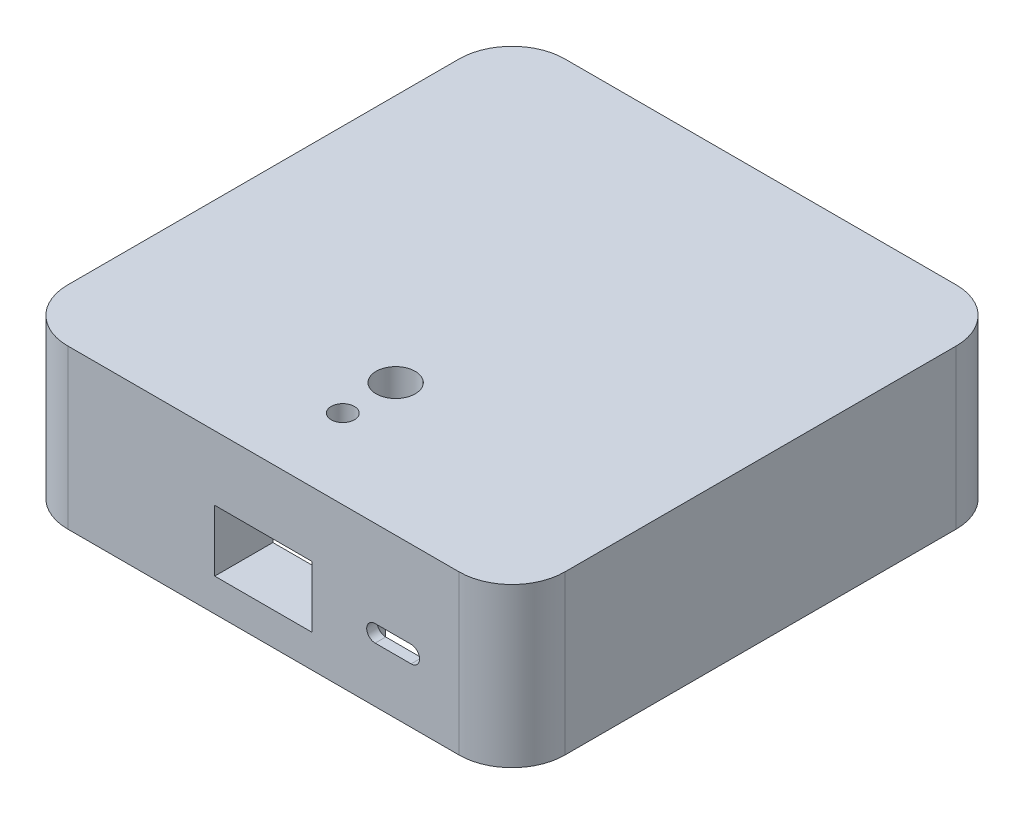
from build123d import *

# Parameters (mm, degrees)
SKETCH_1_W             = 94
SKETCH_1_H             = 94
EXTRUDE_1_DEPTH        = 30
FILLET_1_R             = 10
SHELL_1_T              = -2
SKETCH_2_W             = 24.1
SKETCH_2_H             = 30
EXTRUDE_3392_DEPTH     = 11
CUT_EXTRUDE_3513_REACH = 111.293
SKETCH_3_W             = 18.42
SKETCH_3_H             = 11.6
SKETCH_4_W             = 24.1
SKETCH_4_H             = 24.1
CUT_EXTRUDE_3826_DEPTH = 1.4
EXTRUDE_4548_DEPTH     = 14.2
SKETCH_9_W             = 69.4
SKETCH_9_H             = 9.2
SKETCH_10_W            = 5
SKETCH_10_H            = 5
EXTRUDE_5202_DEPTH     = 24.19
CUT_EXTRUDE_5310_DEPTH = 4
USBC_REACH             = 111.293
USBC_2_DEPTH           = 26
SKETCH_22_W            = 24.1
SKETCH_22_H            = 10.2
EXTRUDE_7617_DEPTH     = 24.95
CUT_EXTRUDE_6_REACH    = 70.81
SKETCH_23_R            = 2.2
SKETCH_23_R_2          = 3.7
SKETCH_13_W            = 10.3
SKETCH_13_H            = 10.3
EXTRUDE_4_DEPTH        = 28
CUT_EXTRUDE_7_DEPTH    = 4


with BuildPart() as part:
    # 草图1 → 凸台-拉伸1 (new body)
    with BuildSketch(Plane(origin=(0, 0, 0), x_dir=(1, 0, 0), z_dir=(0, 1, 0))):
        Rectangle(SKETCH_1_W, SKETCH_1_H)
    extrude(amount=EXTRUDE_1_DEPTH)

    # 圆角1
    fillet_1_edges = [part.edges().sort_by_distance(p)[0] for p in [
        (-47, 15, -47),
        (47, 15, -47),
        (47, 15, 47),
        (-47, 15, 47),
    ]]
    fillet(fillet_1_edges, radius=FILLET_1_R)

    # 抽壳1
    shell_1_openings = [part.faces().sort_by_distance(p)[0] for p in [
        (0, 0, 0),
    ]]
    offset(amount=SHELL_1_T, openings=shell_1_openings, kind=Kind.INTERSECTION)

    # 草图2 → Extrude 3392 (add)
    with BuildSketch(Plane.XY.offset(47)):
        with Locations((0, 15)):
            Rectangle(SKETCH_2_W, SKETCH_2_H)
    extrude(amount=-EXTRUDE_3392_DEPTH)

    # 草图3 → Cut-Extrude 3513 (cut, up to next)
    with BuildSketch(Plane.XY.offset(47), mode=Mode.PRIVATE) as cut_extrude_3513_sk1:
        with Locations((0, 12)):
            Rectangle(SKETCH_3_W, SKETCH_3_H)
    cut_extrude_3513_tool1 = extrude(cut_extrude_3513_sk1.sketch, amount=-CUT_EXTRUDE_3513_REACH, mode=Mode.PRIVATE) & part.part
    add(cut_extrude_3513_tool1.solids().sort_by_distance((0, 12, 47))[0], mode=Mode.SUBTRACT)

    # 草图4 → Cut-Extrude 3826 (cut)
    with BuildSketch(Plane.XZ.offset(-28)):
        with Locations((0, -1)):
            Rectangle(SKETCH_4_W, SKETCH_4_H)
    extrude(amount=-CUT_EXTRUDE_3826_DEPTH, mode=Mode.SUBTRACT)

    # 草图6 → Extrude 4548 (add)
    with BuildSketch(Plane.XZ.offset(-28)):
        with BuildLine():
            Line((-45, -37), (-45, -21.630094022))
            Line((-45, -21.630094022), (45, -21.630094022))
            Line((45, -21.630094022), (45, -37))
            ThreePointArc((45, -37), (42.656854249, -42.656854249), (37, -45))
            Line((37, -45), (-37, -45))
            ThreePointArc((-37, -45), (-42.656854249, -42.656854249), (-45, -37))
        make_face()
    extrude(amount=EXTRUDE_4548_DEPTH)

    # 草图9 → Cut-Revolve 4776 (revolve, cut)
    with BuildSketch(Plane.XZ.offset(-13.8)):
        with Locations((0, -31.2)):
            Rectangle(SKETCH_9_W, SKETCH_9_H)
    revolve(axis=Axis((-34.7, 13.8, -35.8), (1, 0, 0)), mode=Mode.SUBTRACT)

    # 草图10 → Extrude 5202 (add)
    with BuildSketch(Plane.XZ.offset(-28)):
        with Locations((-24, 23)):
            Rectangle(SKETCH_10_W, SKETCH_10_H)
        with Locations((24, -9)):
            Rectangle(SKETCH_10_W, SKETCH_10_H)
    extrude(amount=EXTRUDE_5202_DEPTH)

    # 草图11 → Cut-Extrude 5310 (cut)
    with BuildSketch(Plane.XZ.offset(-3.81)):
        Polygon((-23.076239569, 21.4), (-22.152479139, 23), (-23.076239569, 24.6), (-24.923760431, 24.6), (-25.847520861, 23), (-24.923760431, 21.4), align=None)
        Polygon((24.923760431, -10.6), (25.847520861, -9), (24.923760431, -7.4), (23.076239569, -7.4), (22.152479139, -9), (23.076239569, -10.6), align=None)
    extrude(amount=-CUT_EXTRUDE_5310_DEPTH, mode=Mode.SUBTRACT)

    # 草图15 → USBC (cut, up to next)
    with BuildSketch(Plane.XY.offset(47), mode=Mode.PRIVATE) as usbc_sk1:
        with BuildLine():
            Line((21.125, 13.6), (27.925, 13.6))
            ThreePointArc((27.925, 13.6), (29.525, 12), (27.925, 10.4))
            Line((27.925, 10.4), (21.125, 10.4))
            ThreePointArc((21.125, 10.4), (19.525, 12), (21.125, 13.6))
        make_face()
    usbc_tool1 = extrude(usbc_sk1.sketch, amount=-USBC_REACH, mode=Mode.PRIVATE) & part.part
    add(usbc_tool1.solids().sort_by_distance((24.525, 12, 47))[0], mode=Mode.SUBTRACT)

    # 草图16 → USBC 2 (add)
    with BuildSketch(Plane(origin=(0, 0, 45), x_dir=(-1, 0, 0), z_dir=(0, 0, -1))):
        Polygon((-15.225, 13), (-16.025, 13), (-16.025, 14.6), (-18.858333333, 14.6), (-18.858333333, 28), (-15.225, 28), align=None)
        Polygon((-30.191666667, 28), (-33.825, 28), (-33.825, 13), (-33.025, 13), (-33.025, 14.6), (-30.191666667, 14.6), align=None)
    extrude(amount=USBC_2_DEPTH)

    # 草图22 → Extrude 7617 (add)
    with BuildSketch(Plane(origin=(0, 0, 36), x_dir=(-1, 0, 0), z_dir=(0, 0, -1))):
        with Locations((0, 22.9)):
            Rectangle(SKETCH_22_W, SKETCH_22_H)
    extrude(amount=EXTRUDE_7617_DEPTH)

    # 草图23 → 切除-拉伸6 (cut, up to next)
    with BuildSketch(Plane(origin=(0, 17.8, 0), x_dir=(-1, 0, 0), z_dir=(0, -1, 0)), mode=Mode.PRIVATE) as cut_extrude_6_sk1:
        with Locations(Location((0, -32, 0), (0, 0, 180))):
            Circle(SKETCH_23_R)
    cut_extrude_6_tool1 = extrude(cut_extrude_6_sk1.sketch, amount=-CUT_EXTRUDE_6_REACH, mode=Mode.PRIVATE) & part.part
    # 草图23 → 切除-拉伸6 (cut, up to next)
    with BuildSketch(Plane(origin=(0, 17.8, 0), x_dir=(-1, 0, 0), z_dir=(0, -1, 0)), mode=Mode.PRIVATE) as cut_extrude_6_sk2:
        with Locations(Location((0, -22, 0), (0, 0, 180))):
            Circle(SKETCH_23_R_2)
    cut_extrude_6_tool2 = extrude(cut_extrude_6_sk2.sketch, amount=-CUT_EXTRUDE_6_REACH, mode=Mode.PRIVATE) & part.part
    add(cut_extrude_6_tool1.solids().sort_by_distance((0, 17.8, 32))[0], mode=Mode.SUBTRACT)
    add(cut_extrude_6_tool2.solids().sort_by_distance((0, 17.8, 22))[0], mode=Mode.SUBTRACT)

    # 草图13 → 凸台-拉伸4 (add)
    with BuildSketch(Plane.XZ.offset(-28)):
        with BuildLine():
            Line((-45, -37), (-45, -16.768109074))
            Line((-45, -16.768109074), (-34.7, -16.768109074))
            Line((-34.7, -16.768109074), (-34.7, -45))
            Line((-34.7, -45), (-37, -45))
            ThreePointArc((-37, -45), (-42.656854249, -42.656854249), (-45, -37))
        make_face()
        with BuildLine():
            Line((34.7, -16.768109074), (34.7, -45))
            Line((34.7, -45), (37, -45))
            ThreePointArc((37, -45), (42.656854249, -42.656854249), (45, -37))
            Line((45, -37), (45, -16.768109074))
            Line((45, -16.768109074), (34.7, -16.768109074))
        make_face()
        with Locations((-39.85, 31.85)):
            Rectangle(SKETCH_13_W, SKETCH_13_H)
        with Locations((39.85, 31.85)):
            Rectangle(SKETCH_13_W, SKETCH_13_H)
    extrude(amount=EXTRUDE_4_DEPTH)

    # 草图26 → 切除-拉伸7 (cut)
    with BuildSketch(Plane.XZ):
        Polygon((-40.85, 30.117949192), (-38.85, 30.117949192), (-37.85, 31.85), (-38.85, 33.582050808), (-40.85, 33.582050808), (-41.85, 31.85), align=None)
        Polygon((40.85, 33.582050808), (41.85, 31.85), (40.85, 30.117949192), (38.85, 30.117949192), (37.85, 31.85), (38.85, 33.582050808), align=None)
        Polygon((40.85, -23.267949192), (41.85, -25), (40.85, -26.732050808), (38.85, -26.732050808), (37.85, -25), (38.85, -23.267949192), align=None)
        Polygon((-40.85, -23.267949192), (-41.85, -25), (-40.85, -26.732050808), (-38.85, -26.732050808), (-37.85, -25), (-38.85, -23.267949192), align=None)
    extrude(amount=-CUT_EXTRUDE_7_DEPTH, mode=Mode.SUBTRACT)


solid = part.part
